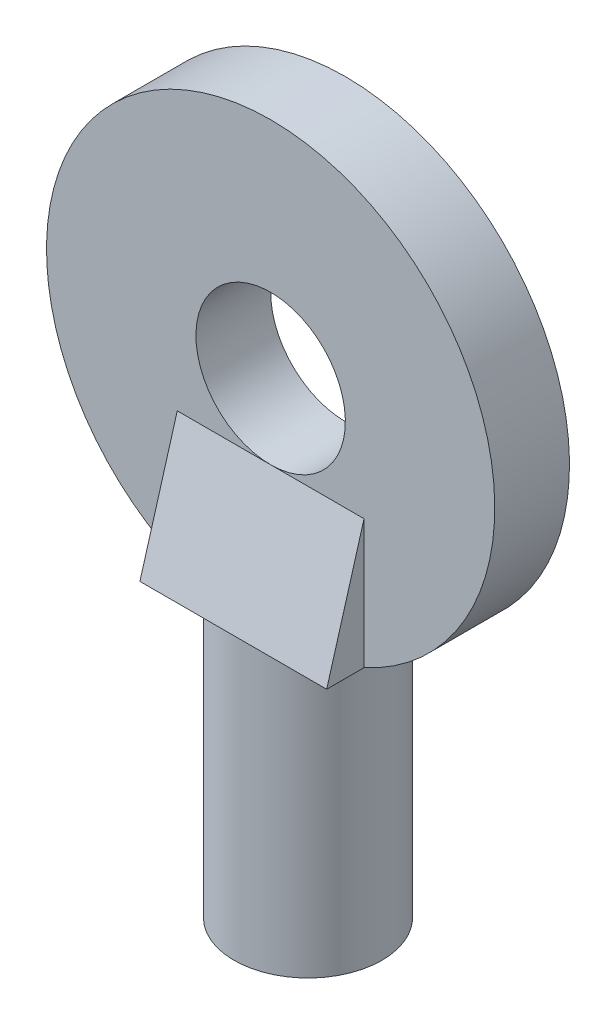
from build123d import *

# Parameters (mm, degrees)
BOSS_EXTRUDE1_DEPTH      = 2
BOSS_EXTRUDE3_DEPTH      = 1
BOSS_EXTRUDE3_DEPTH_BACK = 3
SKETCH3_W                = 5
SKETCH3_H                = 4
SKETCH3_R                = 1.980106187
CUT_EXTRUDE1_DEPTH       = 7.545644
CUT_EXTRUDE2_DEPTH       = 8
SKETCH6_R                = 0.4
CUT_EXTRUDE3_DEPTH       = 4


with BuildPart() as part:
    # Sketch1 → Boss-Extrude1 (new body)
    with BuildSketch(Plane.XY):
        with BuildLine():
            ThreePointArc((0, 2), (1.414213562, 1.414213562), (2, 0))
            Line((2, 0), (6, 0))
            ThreePointArc((6, 0), (0, 6), (-6, 0))
            Line((-6, 0), (-2, 0))
            ThreePointArc((-2, 0), (-1.414213562, 1.414213562), (0, 2))
        make_face()
        with BuildLine():
            Line((6, 0), (2, 0))
            ThreePointArc((2, 0), (1.414213562, -1.414213562), (0, -2))
            ThreePointArc((0, -2), (-1.414213562, -1.414213562), (-2, 0))
            Line((-2, 0), (-6, 0))
            ThreePointArc((-6, 0), (0, -6), (6, 0))
        make_face()
    extrude(amount=-BOSS_EXTRUDE1_DEPTH)

    # Sketch2 → Boss-Extrude3 (add, two sides: drawn at the far end of the back side and taken through both)
    with BuildSketch(Plane.XY.offset(-BOSS_EXTRUDE3_DEPTH_BACK)):
        Polygon((-2.5, -13), (2.5, -13), (2.5, -5.454356057), (2.5, -2), (-2.5, -2), (-2.5, -5.454356057), align=None)
    extrude(amount=BOSS_EXTRUDE3_DEPTH + BOSS_EXTRUDE3_DEPTH_BACK)

    # Sketch3 → Cut-Extrude1 (cut)
    with BuildSketch(Plane.XZ.offset(13)):
        with Locations((0, -1)):
            Rectangle(SKETCH3_W, SKETCH3_H)
        with Locations((0, -1)):
            Circle(SKETCH3_R, mode=Mode.SUBTRACT)
    extrude(amount=-CUT_EXTRUDE1_DEPTH, mode=Mode.SUBTRACT)

    # Sketch5 → Cut-Extrude2 (cut)
    with BuildSketch(Plane(origin=(2.5, 0, 0), x_dir=(0, 0, -1), z_dir=(1, 0, 0))):
        Polygon((-1, -5.454356057), (0, -2), (-1, -2), align=None)
        Polygon((3, -5.454356057), (2, -2), (3, -2), align=None)
    extrude(amount=-CUT_EXTRUDE2_DEPTH, mode=Mode.SUBTRACT)

    # Sketch6 → Cut-Extrude3 (cut)
    with BuildSketch(Plane.XZ.offset(13)):
        with Locations((0, -1)):
            Circle(SKETCH6_R)
    extrude(amount=-CUT_EXTRUDE3_DEPTH, mode=Mode.SUBTRACT)


solid = part.part
